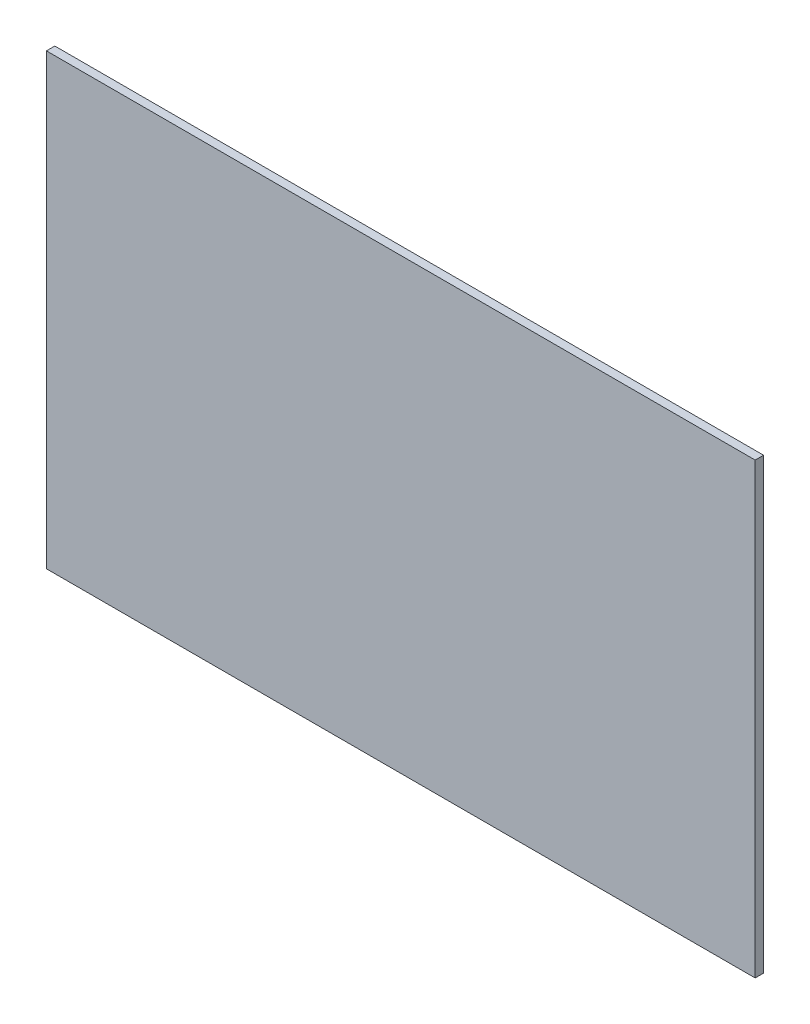
from build123d import *

# Parameters (mm, degrees)
CROQUIS1_W              = 253.222947295
CROQUIS1_H              = 160.249264991
SALIENTE_EXTRUIR1_DEPTH = 3


with BuildPart() as part:
    # Croquis1 → Saliente-Extruir1 (new body)
    with BuildSketch(Plane.XY):
        with Locations((-57.265648966, -54.660379097)):
            Rectangle(CROQUIS1_W, CROQUIS1_H)
    extrude(amount=SALIENTE_EXTRUIR1_DEPTH)


solid = part.part
